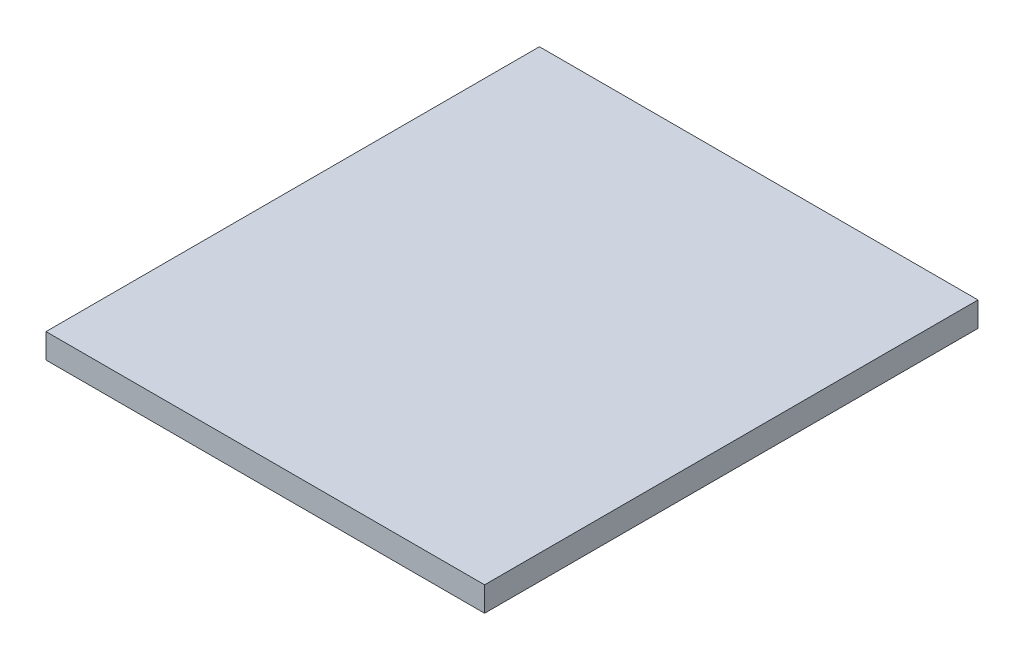
from build123d import *

# Parameters (mm, degrees)
SKETCH1_W           = 160
SKETCH1_H           = 180
BOSS_EXTRUDE1_DEPTH = 4.5


with BuildPart() as part:
    # Sketch1 → Boss-Extrude1 (new, symmetric)
    with BuildSketch(Plane(origin=(0, 0, 0), x_dir=(1, 0, 0), z_dir=(0, 1, 0))):
        Rectangle(SKETCH1_W, SKETCH1_H)
    extrude(amount=BOSS_EXTRUDE1_DEPTH, both=True)


solid = part.part
